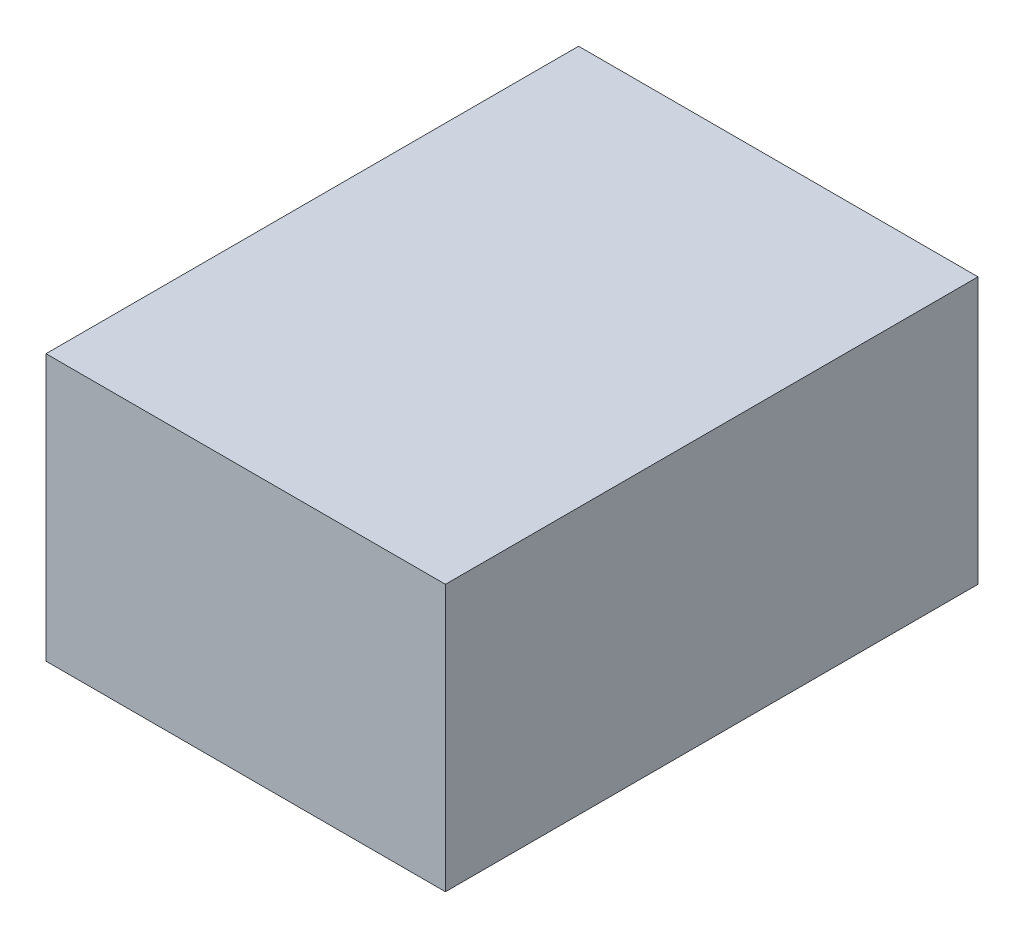
from build123d import *

# Parameters (mm, degrees)
SKETCH_1_W      = 6
SKETCH_1_H      = 8
EXTRUDE_1_DEPTH = 4


with BuildPart() as part:
    # 草图1 → 凸台-拉伸1 (new body)
    with BuildSketch(Plane(origin=(0, 0, 0), x_dir=(1, 0, 0), z_dir=(0, 1, 0))):
        with Locations((-16.389643608, 12.965938157)):
            Rectangle(SKETCH_1_W, SKETCH_1_H)
    extrude(amount=EXTRUDE_1_DEPTH)


solid = part.part
